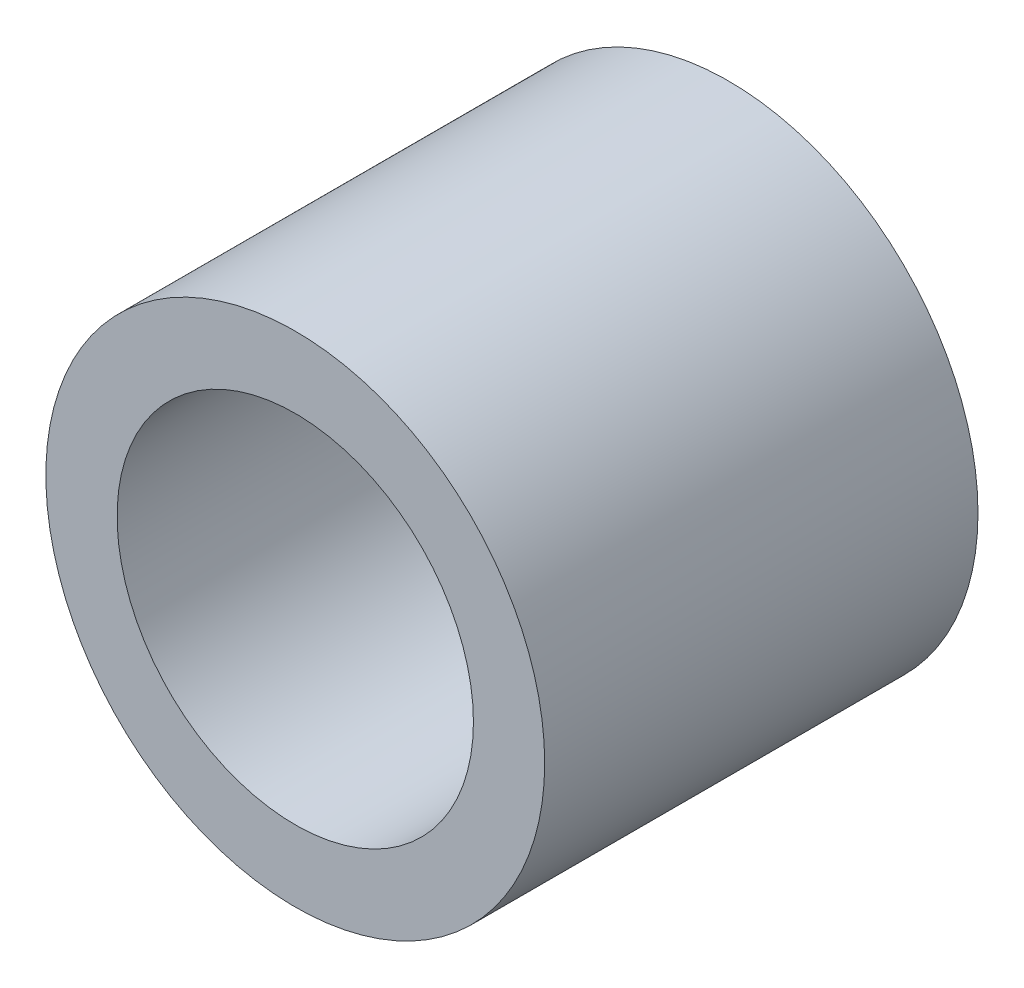
from build123d import *

# Parameters (mm, degrees)
SKETCH1_R           = 11.1125
SKETCH1_R_2         = 7.9375
BOSS_EXTRUDE1_DEPTH = 19.304


with BuildPart() as part:
    # Sketch1 → Boss-Extrude1 (new body)
    with BuildSketch(Plane(origin=(0, 0, 0), x_dir=(0, 1, 0), z_dir=(0, 0, 1))):
        with Locations(Location((0, 0, 0), (0, 0, 270))):
            Circle(SKETCH1_R)
        with Locations(Location((0, 0, 0), (0, 0, 270))):
            Circle(SKETCH1_R_2, mode=Mode.SUBTRACT)
    extrude(amount=BOSS_EXTRUDE1_DEPTH)


solid = part.part
